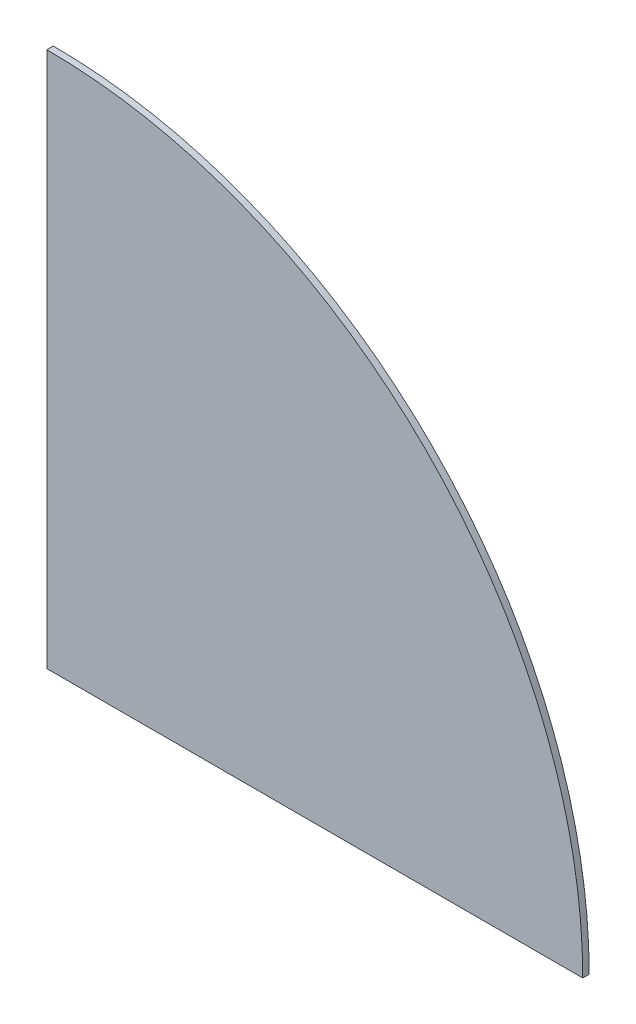
from build123d import *

# Parameters (mm, degrees)
BOSS_EXTRUDE1_DEPTH = 1.6


with BuildPart() as part:
    # Sketch1 → Boss-Extrude1 (new body)
    with BuildSketch(Plane.XY):
        with BuildLine():
            Line((0, 0), (0, 133))
            ThreePointArc((0, 133), (94.045201898, 94.045201898), (133, 0))
            Line((133, 0), (0, 0))
        make_face()
    extrude(amount=BOSS_EXTRUDE1_DEPTH)


solid = part.part
